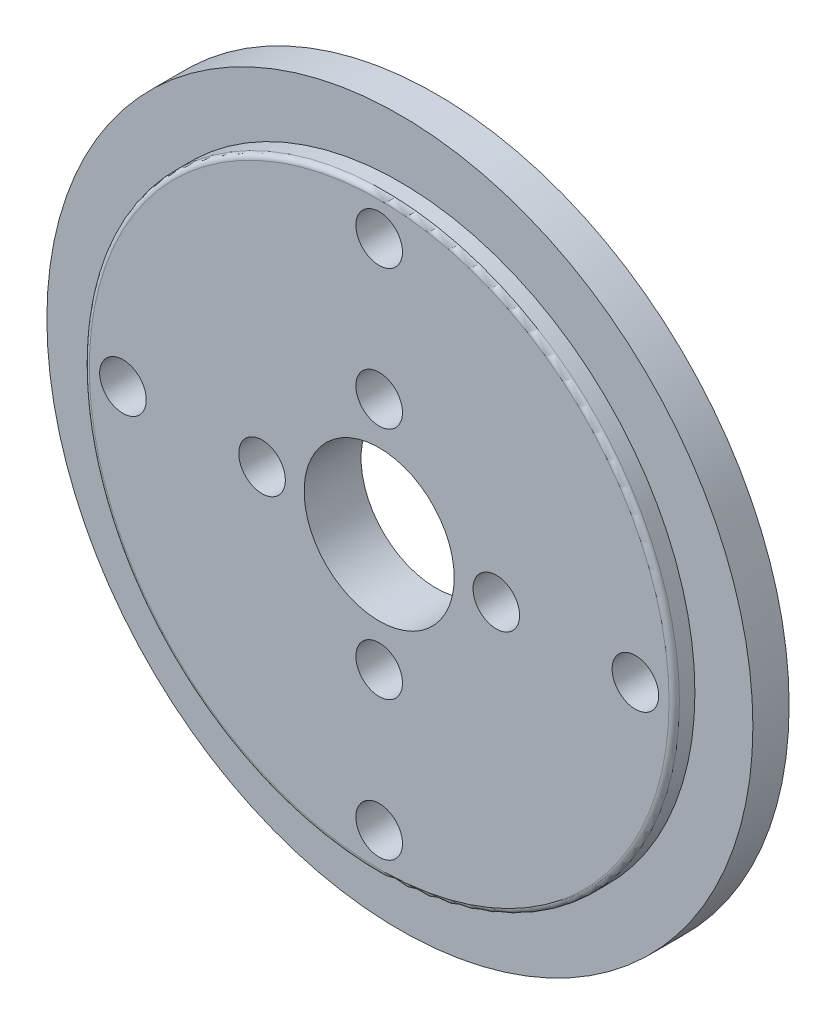
from build123d import *

# Parameters (mm, degrees)
SKETCH1_R               = 34.1
BOSS_EXTRUDE1_DEPTH     = 1.75
SKETCH4_R               = 28.5
BOSS_EXTRUDE2_DEPTH     = 2
CUT_EXTRUDE2_DEPTH      = 49.351525312
CUT_EXTRUDE2_DEPTH_BACK = 49.351525312
SKETCH3_R               = 2.25
CUT_EXTRUDE1_DEPTH      = 49.351525312
CUT_EXTRUDE1_DEPTH_BACK = 49.351525312
SKETCH2_R               = 7.25
FILLET1_R               = 0.5


with BuildPart() as part:
    # Sketch1 → Boss-Extrude1 (new, symmetric)
    with BuildSketch(Plane.XY):
        Circle(SKETCH1_R)
    extrude(amount=BOSS_EXTRUDE1_DEPTH, both=True)

    # Sketch4 → Boss-Extrude2 (add)
    with BuildSketch(Plane.XY.offset(1.75)):
        Circle(SKETCH4_R)
    extrude(amount=BOSS_EXTRUDE2_DEPTH)

    # Sketch3 → Cut-Extrude2 (cut, two sides: drawn at the far end of the back side and taken through both)
    with BuildSketch(Plane.XY.offset(1.75).offset(-CUT_EXTRUDE2_DEPTH_BACK)):
        with Locations((0, 24.75)):
            Circle(SKETCH3_R)
        with Locations((0, 11.3137085)):
            Circle(SKETCH3_R)
        with Locations((24.75, 0)):
            Circle(SKETCH3_R)
        with Locations((11.3137085, 0)):
            Circle(SKETCH3_R)
        with Locations((0, -24.75)):
            Circle(SKETCH3_R)
        with Locations((0, -11.3137085)):
            Circle(SKETCH3_R)
        with Locations((-24.75, 0)):
            Circle(SKETCH3_R)
        with Locations((-11.3137085, 0)):
            Circle(SKETCH3_R)
    extrude(amount=CUT_EXTRUDE2_DEPTH + CUT_EXTRUDE2_DEPTH_BACK, mode=Mode.SUBTRACT)

    # Sketch2 → Cut-Extrude1 (cut, two sides: drawn at the far end of the back side and taken through both)
    with BuildSketch(Plane.XY.offset(1.75).offset(-CUT_EXTRUDE1_DEPTH_BACK)):
        Circle(SKETCH2_R)
    extrude(amount=CUT_EXTRUDE1_DEPTH + CUT_EXTRUDE1_DEPTH_BACK, mode=Mode.SUBTRACT)

    # Fillet1
    fillet1_edges = [part.edges().sort_by_distance(p)[0] for p in [
        (-28.5, 0, 3.75),
    ]]
    fillet(fillet1_edges, radius=FILLET1_R)


solid = part.part
